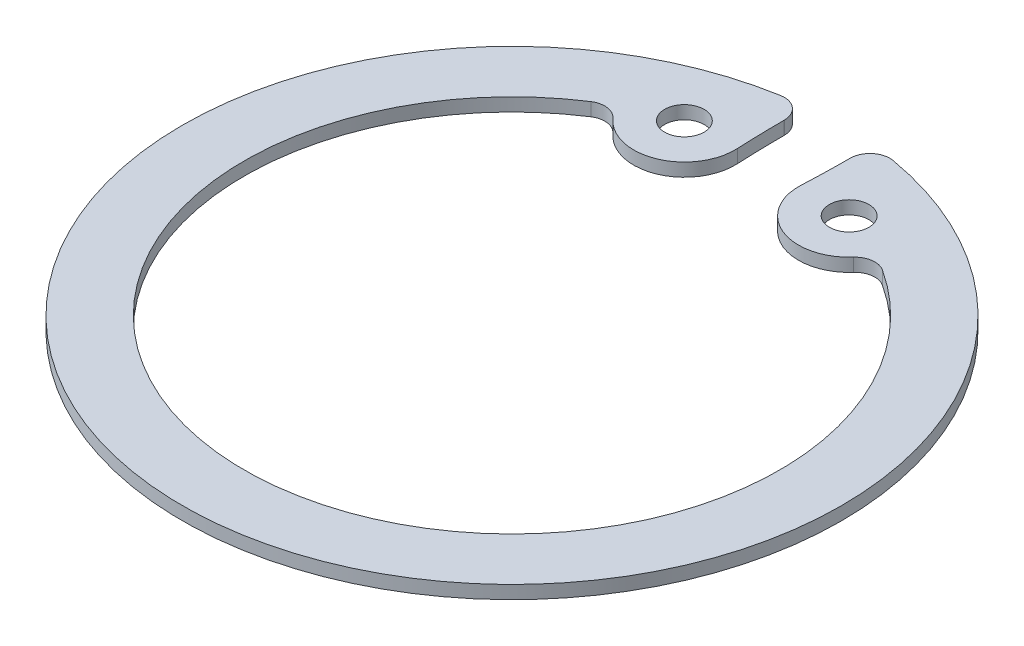
from build123d import *

# Parameters (mm, degrees)
SKETCH1_R           = 12.7
SKETCH1_R_2         = 10.31875
BOSS_EXTRUDE1_DEPTH = 0.508
SKETCH2_W           = 2.54
SKETCH2_H           = 4.365272308
CUT_EXTRUDE1_DEPTH  = 0.508
FILLET1_R           = 0.762
BOSS_EXTRUDE2_START = -0.508
BOSS_EXTRUDE2_DEPTH = 0.508
SKETCH4_R           = 0.762
CUT_EXTRUDE2_DEPTH  = 0.508
CUT_EXTRUDE4_DEPTH  = 12.7
FILLET2_R           = 0.762
FILLET3_R           = 38.862


with BuildPart() as part:
    # Sketch1 → Boss-Extrude1 (new body)
    with BuildSketch(Plane(origin=(0, 0, 0), x_dir=(1, 0, 0), z_dir=(0, 1, 0))):
        with Locations(Location((0, 0, 0), (0, 0, 270))):
            Circle(SKETCH1_R)
        with Locations(Location((0, 0, 0), (0, 0, 270))):
            Circle(SKETCH1_R_2, mode=Mode.SUBTRACT)
    extrude(amount=BOSS_EXTRUDE1_DEPTH)

    # Sketch2 → Cut-Extrude1 (cut)
    with BuildSketch(Plane(origin=(0, 0.508, 0), x_dir=(1, 0, 0), z_dir=(0, 1, 0))):
        with Locations((0, 11.342245997)):
            Rectangle(SKETCH2_W, SKETCH2_H)
    extrude(amount=-CUT_EXTRUDE1_DEPTH, mode=Mode.SUBTRACT)

    # Fillet1
    fillet1_edges = [part.edges().sort_by_distance(p)[0] for p in [
        (-1.27, 0.254, -12.636340451),
        (1.27, 0.254, -12.636340451),
    ]]
    fillet(fillet1_edges, radius=FILLET1_R)

    # Sketch3 → Boss-Extrude2 (add)
    with BuildSketch(Plane(origin=(0, 0.508, 0), x_dir=(1, 0, 0), z_dir=(0, 1, 0)).offset(BOSS_EXTRUDE2_START)):
        with BuildLine():
            ThreePointArc((1.27, 10.240297924), (2.574626321, 7.9615922), (4.966472896, 9.044929438))
            ThreePointArc((4.966472896, 9.044929438), (3.175, 9.818145271), (1.27, 10.240297924))
        make_face()
    extrude(amount=BOSS_EXTRUDE2_DEPTH)

    # Sketch4 → Cut-Extrude2 (cut)
    with BuildSketch(Plane(origin=(0, 0.508, 0), x_dir=(-1, 0, 0), z_dir=(0, 1, 0))):
        with Locations(Location((-3.175, -9.818145271, 0), (0, 0, 90))):
            Circle(SKETCH4_R)
    extrude(amount=-CUT_EXTRUDE2_DEPTH, mode=Mode.SUBTRACT)

    # Sketch5 → Cut-Extrude4 (cut, symmetric)
    with BuildSketch(Plane(origin=(0, 0, 0), x_dir=(1, 0, 0), z_dir=(0, 1, 0))):
        Polygon((0, 13.122692647), (0, -13.667441161), (-16.637303015, -10.48078624), (-17.785980951, 10.084254234), (-7.744312539, 13.715558678), align=None)
    extrude(amount=CUT_EXTRUDE4_DEPTH, both=True, mode=Mode.SUBTRACT)

    # Fillet2
    fillet2_edges = [part.edges().sort_by_distance(p)[0] for p in [
        (4.966472896, 0.254, -9.044929438),
    ]]
    fillet(fillet2_edges, radius=FILLET2_R)

    # Fillet3
    fillet3_edges = [part.edges().sort_by_distance(p)[0] for p in [
        (1.27, 0.254, -10.240297924),
    ]]
    fillet(fillet3_edges, radius=FILLET3_R)

    # Mirror1: part across plane


with BuildPart() as part_1:
    add(part.part)
    add(part.part.mirror(Plane(origin=(0, 0, 0), x_dir=(0, 0, 1), z_dir=(1, 0, 0))))


solid = part_1.part
